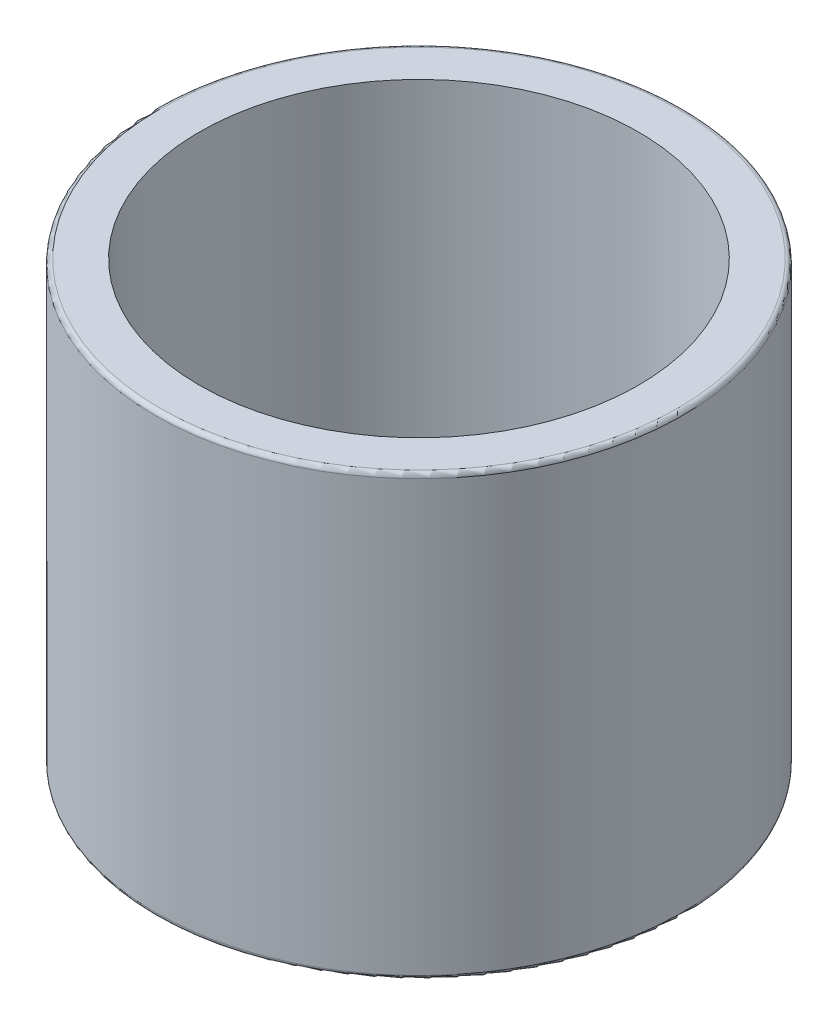
from build123d import *

# Parameters (mm, degrees)
SKIZZE1_R                       = 6
SKIZZE1_R_2                     = 5
AUFSATZ_LINEAR_AUSTRAGEN1_DEPTH = 5
VERRUNDUNG1_R                   = 0.1


with BuildPart() as part:
    # Skizze1 → Aufsatz-Linear austragen1 (new, symmetric)
    with BuildSketch(Plane(origin=(0, 0, 0), x_dir=(1, 0, 0), z_dir=(0, 1, 0))):
        with Locations(Location((0, 0, 0), (0, 0, 270))):
            Circle(SKIZZE1_R)
        with Locations(Location((0, 0, 0), (0, 0, 270))):
            Circle(SKIZZE1_R_2, mode=Mode.SUBTRACT)
    extrude(amount=AUFSATZ_LINEAR_AUSTRAGEN1_DEPTH, both=True)

    # Verrundung1
    verrundung1_edges = [part.edges().sort_by_distance(p)[0] for p in [
        (0, -5, -6),
        (0, 5, -6),
    ]]
    fillet(verrundung1_edges, radius=VERRUNDUNG1_R)


solid = part.part
